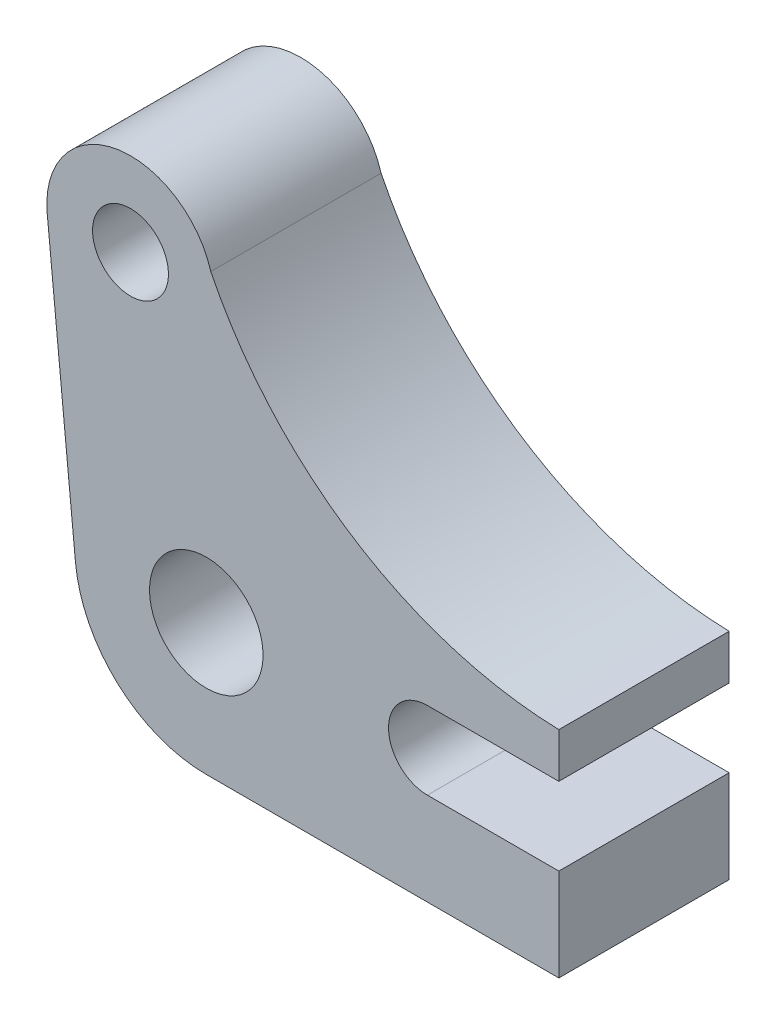
from build123d import *

# Parameters (mm, degrees)
ESQUISSE1_R        = 6.35
ESQUISSE1_R_2      = 9.5
BOSS_EXTRU_1_DEPTH = 28.5


with BuildPart() as part:
    # Esquisse1 → Boss.-Extru.1 (new body)
    with BuildSketch(Plane.XY):
        with BuildLine():
            Line((-86.633280406, -6.99307262), (-81.912918385, -55.104590809))
            ThreePointArc((-81.912918385, -55.104590809), (-74.795399572, -69.254576275), (-60.018047616, -74.956420883))
            Line((-60.018047616, -74.956420883), (-1.018047616, -74.956420883))
            Line((-1.018047616, -74.956420883), (-1.018047616, -59.456420883))
            Line((-1.018047616, -59.456420883), (-23.018047616, -59.456420883))
            ThreePointArc((-23.018047616, -59.456420883), (-29.518047616, -52.956420883), (-23.018047616, -46.456420883))
            Line((-23.018047616, -46.456420883), (-1.018047616, -46.456420883))
            Line((-1.018047616, -46.456420883), (-1.018047616, -38.956420883))
            ThreePointArc((-1.018047616, -38.956420883), (-35.318453229, -28.420111536), (-59.263146108, -1.695902984))
            ThreePointArc((-59.263146108, -1.695902984), (-75.360354059, 8.118888343), (-86.633280406, -6.99307262))
        make_face()
        with Locations(Location((-72.700180587, -5.626055331, 0), (0, 0, 180))):
            Circle(ESQUISSE1_R, mode=Mode.SUBTRACT)
        with Locations(Location((-60.018047616, -52.956420883, 0), (0, 0, 180))):
            Circle(ESQUISSE1_R_2, mode=Mode.SUBTRACT)
    extrude(amount=BOSS_EXTRU_1_DEPTH)


solid = part.part
